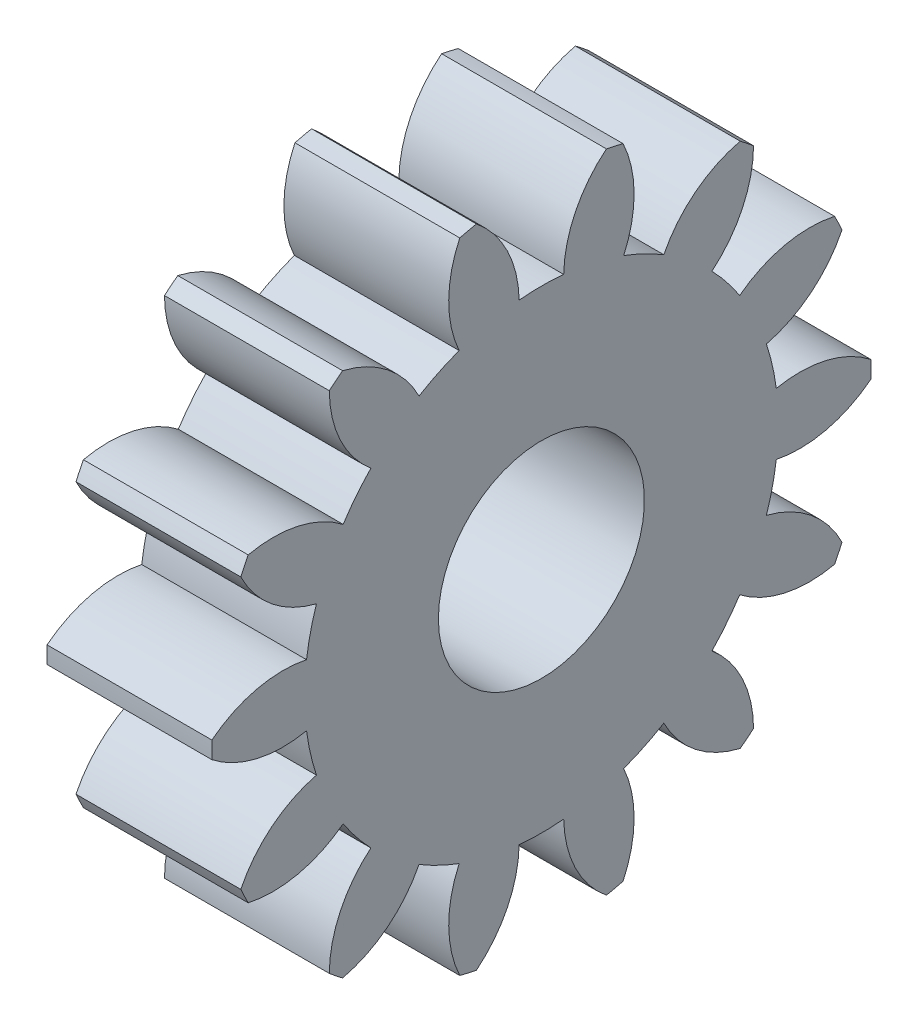
from build123d import *

# Parameters (mm, degrees)
BASPROSKE_W     = 4
BASPROSKE_H     = 8
TOOTHCUT_DEPTH  = 13
TEETHCUTS_COUNT = 14
TEETHCUTS_ANGLE = 334.285714286
BORSKE_R        = 2.5
BORE_DEPTH      = 50.0000508


with BuildPart() as part:
    # BasProSke → Base-Revolve (revolve)
    with BuildSketch(Plane(origin=(0, 0, 0), x_dir=(1, 0, 0), z_dir=(0, 1, 0)), mode=Mode.PRIVATE) as base_revolve_sk:
        with Locations((2, 4)):
            Rectangle(BASPROSKE_W, BASPROSKE_H)
    revolve(base_revolve_sk.sketch.rotate(Axis((-10, 0, 0), (1, 0, 0)), 180), axis=Axis((-10, 0, 0), (1, 0, 0)))

    # TooCutSke → ToothCut (cut, through all)
    with BuildSketch(Plane(origin=(0, 0, 0), x_dir=(0, 0, -1), z_dir=(1, 0, 0))):
        with BuildLine():
            ThreePointArc((0.540393256, 5.723545765), (0, 5.749), (-0.540393256, 5.723545765))
            ThreePointArc((-0.540393256, 5.723545765), (-0.832220085, 6.912663993), (-1.603550271, 7.863566092))
            ThreePointArc((-1.603550271, 7.863566092), (0, 8.0254), (1.603550271, 7.863566092))
            ThreePointArc((1.603550271, 7.863566092), (0.832220085, 6.912663993), (0.540393256, 5.723545765))
        make_face()
    toothcut = extrude(amount=TOOTHCUT_DEPTH, mode=Mode.SUBTRACT)

    # TeethCuts: ToothCut ×14 about axis
    teethcuts_axis = Axis((-10, 0, 0), (1, 0, 0))
    for i in range(1, TEETHCUTS_COUNT):
        add(toothcut.rotate(teethcuts_axis, i * TEETHCUTS_ANGLE / (TEETHCUTS_COUNT - 1)), mode=Mode.SUBTRACT)

    # BorSke → Bore (cut, symmetric)
    with BuildSketch(Plane(origin=(0, 0, 0), x_dir=(0, 0, -1), z_dir=(1, 0, 0))):
        with Locations(Location((0, 0, 0), (0, 0, 180))):
            Circle(BORSKE_R)
    extrude(amount=BORE_DEPTH, both=True, mode=Mode.SUBTRACT)


solid = part.part
